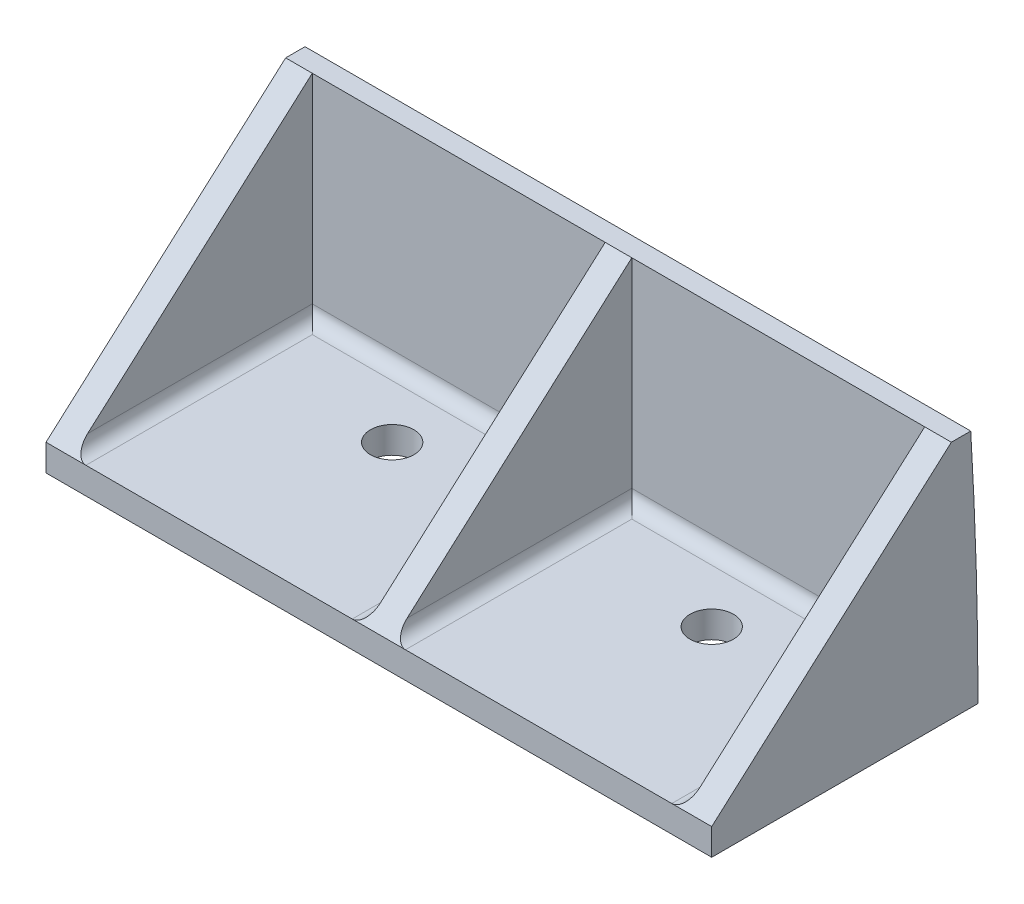
from build123d import *

# Parameters (mm, degrees)
SKETCH5_W            = 25
SKETCH5_H            = 20
BOSS_EXTRUDE3_DEPTH  = 2
SKETCH6_W            = 25
SKETCH6_H            = 2
BOSS_EXTRUDE4_DEPTH  = 16
BOSS_EXTRUDE5_DEPTH  = 2
BOSS_EXTRUDE6_DEPTH  = 1
SKETCH9_R            = 1.63
CUT_EXTRUDE2_DEPTH   = 23.632940596
FILLET1_R            = 1
SKETCH10_R           = 307
SKETCH10_R_2         = 297
CUT_EXTRUDE3_DEPTH   = 33.388269481
FILLET1_OF_MIRROR3_R = 1


with BuildPart() as part:
    # Sketch5 → Boss-Extrude3 (new body)
    with BuildSketch(Plane(origin=(0, 0, 0), x_dir=(1, 0, 0), z_dir=(0, 1, 0))):
        Rectangle(SKETCH5_W, SKETCH5_H)
    boss_extrude3 = extrude(amount=BOSS_EXTRUDE3_DEPTH)

    # Sketch6 → Boss-Extrude4 (add)
    with BuildSketch(Plane(origin=(0, 2, 0), x_dir=(1, 0, 0), z_dir=(0, 1, 0))):
        with Locations((0, 9)):
            Rectangle(SKETCH6_W, SKETCH6_H)
    boss_extrude4 = extrude(amount=BOSS_EXTRUDE4_DEPTH)

    # Sketch7 → Boss-Extrude5 (add)
    with BuildSketch(Plane(origin=(12.5, 0, 0), x_dir=(0, 0, -1), z_dir=(1, 0, 0))):
        Polygon((8, 18), (-10, 2), (8, 2), align=None)
    boss_extrude5 = extrude(amount=-BOSS_EXTRUDE5_DEPTH)

    # Sketch8 → Boss-Extrude6 (add)
    with BuildSketch(Plane.ZY.offset(12.5)):
        Polygon((-8, 18), (-8, 2), (10, 2), align=None)
    boss_extrude6 = extrude(amount=-BOSS_EXTRUDE6_DEPTH)

    # Sketch9 → Cut-Extrude2 (cut, symmetric)
    with BuildSketch(Plane(origin=(0, 2, 0), x_dir=(1, 0, 0), z_dir=(0, 1, 0))):
        with Locations(Location((-0.5, 3, 0), (0, 0, 270))):
            Circle(SKETCH9_R)
    cut_extrude2 = extrude(amount=CUT_EXTRUDE2_DEPTH, both=True, mode=Mode.SUBTRACT)

    # Fillet1
    fillet1_edges = [part.edges().sort_by_distance(p)[0] for p in [
        (10.5, 2, 1),
        (-0.5, 2, -8),
        (-11.5, 2, 1),
    ]]
    fillet(fillet1_edges, radius=FILLET1_R)

    # Sketch10 → Cut-Extrude3 (cut, through all)
    with BuildSketch(Plane(origin=(12.5, 0, 0), x_dir=(0, 0, -1), z_dir=(1, 0, 0))):
        with Locations((-287, 0)):
            Circle(SKETCH10_R)
        with Locations((-287, 0)):
            Circle(SKETCH10_R_2, mode=Mode.SUBTRACT)
    cut_extrude3 = extrude(amount=-CUT_EXTRUDE3_DEPTH, mode=Mode.SUBTRACT)


with BuildPart() as mirror3_1:
    # Mirror3: Boss-Extrude3, Boss-Extrude4, Boss-Extrude5, Boss-Extrude6 across plane
    add(boss_extrude3.mirror(Plane(origin=(-12.5, 2, -10), x_dir=(0, 0, 1), z_dir=(1, 0, 0))))
    add(boss_extrude4.mirror(Plane(origin=(-12.5, 2, -10), x_dir=(0, 0, 1), z_dir=(1, 0, 0))))
    add(boss_extrude5.mirror(Plane(origin=(-12.5, 2, -10), x_dir=(0, 0, 1), z_dir=(1, 0, 0))))
    add(boss_extrude6.mirror(Plane(origin=(-12.5, 2, -10), x_dir=(0, 0, 1), z_dir=(1, 0, 0))))

    # Mirror3 2: Cut-Extrude2, Cut-Extrude3 across plane
    add(cut_extrude2.mirror(Plane(origin=(-12.5, 2, -10), x_dir=(0, 0, 1), z_dir=(1, 0, 0))), mode=Mode.SUBTRACT)
    add(cut_extrude3.mirror(Plane(origin=(-12.5, 2, -10), x_dir=(0, 0, 1), z_dir=(1, 0, 0))), mode=Mode.SUBTRACT)

    # Fillet1 of Mirror3
    fillet1_of_mirror3_edges = [mirror3_1.edges().sort_by_distance(p)[0] for p in [
        (-35.5, 2, 1),
        (-24.5, 2, -8),
        (-13.5, 2, 1),
    ]]
    fillet(fillet1_of_mirror3_edges, radius=FILLET1_OF_MIRROR3_R)


with BuildPart() as part_1:
    add(part.part)

    # Mirror3 united with what the copies touc: union Mirror3_1
    add(mirror3_1.part)


solid = part_1.part
